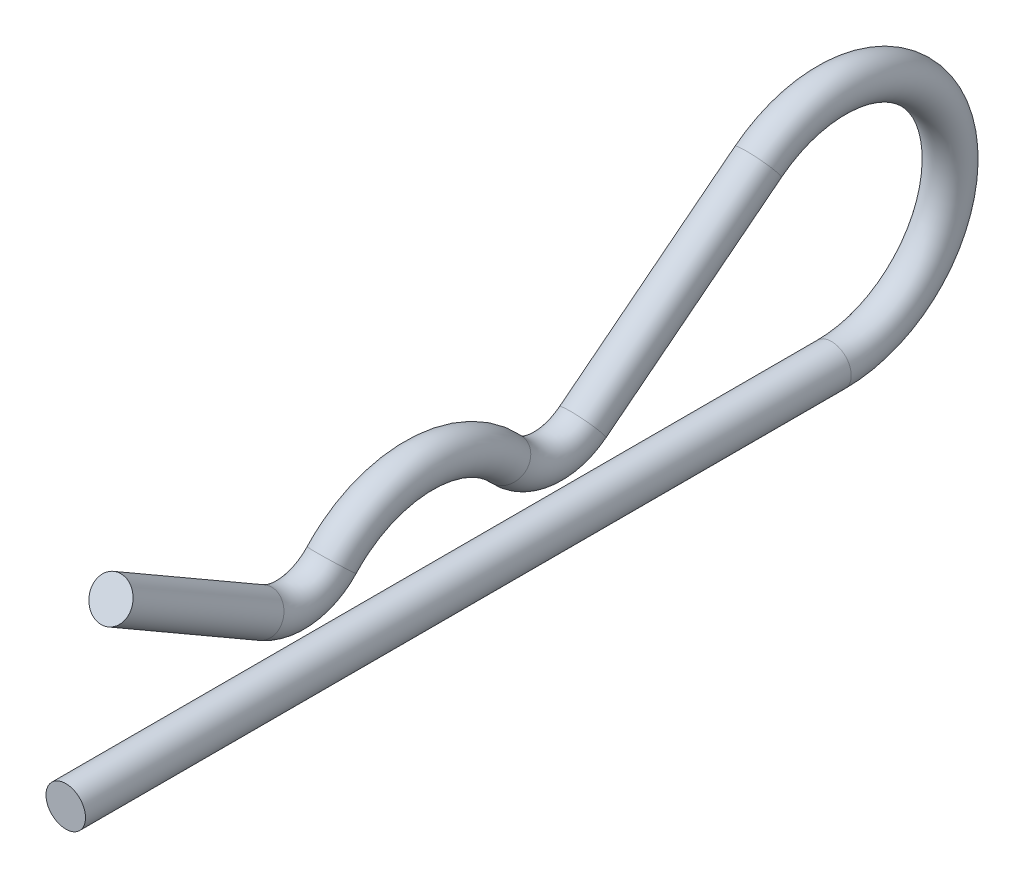
from build123d import *

# Parameters (mm, degrees)
SKETCH1_R = 1


with BuildPart() as part:
    # Sweep1: sweep along a path in Sketch2
    with BuildLine(Plane(origin=(0, 0, 0), x_dir=(0, 0, -1), z_dir=(1, 0, 0))) as sweep1_path:
        Line((0, 0), (38.72, 0))
        ThreePointArc((38.72, 0), (44.390888981, 7.959851567), (35.015299782, 10.719660612))
        Line((35.015299782, 10.719660612), (26.139431104, 3.752542566))
        ThreePointArc((26.139431104, 3.752542566), (24.145464184, 3.152115477), (22.273582291, 4.064516129))
        ThreePointArc((22.273582291, 4.064516129), (17.86, 6), (13.446417709, 4.064516129))
        ThreePointArc((13.446417709, 4.064516129), (11.775842811, 3.175572375), (9.916140428, 3.525641703))
        Line((9.916140428, 3.525641703), (2.286, 7.930905334))
    # Sketch1 → Sweep1 (sweep)
    with BuildSketch(Plane.XY):
        Circle(SKETCH1_R)
    sweep(path=sweep1_path.line)


solid = part.part
